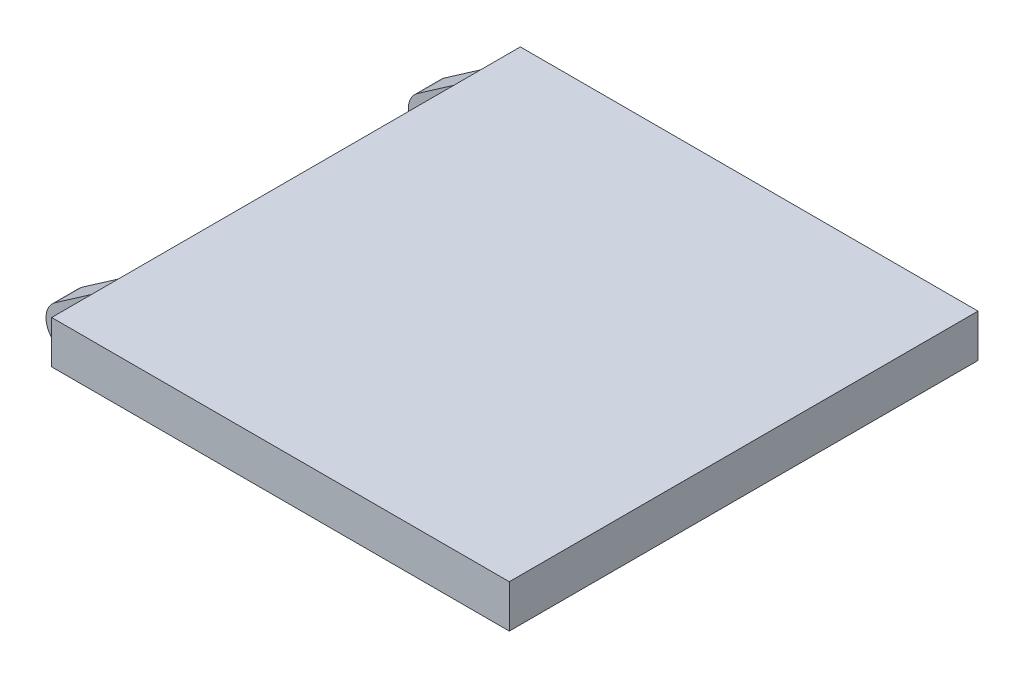
from build123d import *

# Parameters (mm, degrees)
SKETCH1_W           = 85.558202154
SKETCH1_H           = 87.623993754
BOSS_EXTRUDE1_DEPTH = 8
BOSS_EXTRUDE2_START = 0.6
BOSS_EXTRUDE2_DEPTH = 5
SKETCH3_R           = 2
BOSS_EXTRUDE3_DEPTH = 3.8
BOSS_EXTRUDE3_TAPER = 14
FILLET1_R           = 1


with BuildPart() as part:
    # Sketch1 → Boss-Extrude1 (new body)
    with BuildSketch(Plane(origin=(0, 0, 0), x_dir=(1, 0, 0), z_dir=(0, 1, 0))):
        Rectangle(SKETCH1_W, SKETCH1_H)
    extrude(amount=BOSS_EXTRUDE1_DEPTH)


with BuildPart() as body_2:
    # Sketch2 → Boss-Extrude2 (new body)
    with BuildSketch(Plane(origin=(0, 0, 36.97), x_dir=(-1, 0, 0), z_dir=(0, 0, -1)).offset(BOSS_EXTRUDE2_START)):
        with BuildLine():
            Line((42.779101077, 0), (42.779101077, 8))
            Line((42.779101077, 8), (49.562346018, 3.284325279))
            ThreePointArc((49.562346018, 3.284325279), (49.132074395, -3.544924524), (43.279101077, 0))
            Line((43.279101077, 0), (42.779101077, 0))
        make_face()
    extrude(amount=BOSS_EXTRUDE2_DEPTH)


with BuildPart() as body_3:
    # Sketch3 → Boss-Extrude3 (new body)
    with BuildSketch(Plane(origin=(0, 0, 36.97), x_dir=(-1, 0, 0), z_dir=(0, 0, -1))):
        with Locations((47.279101077, 0)):
            Circle(SKETCH3_R)
    extrude(amount=BOSS_EXTRUDE3_DEPTH, taper=BOSS_EXTRUDE3_TAPER)

    # Fillet1
    fillet1_edges = [body_3.edges().sort_by_distance(p)[0] for p in [
        (-46.226547488, 0, 33.17),
    ]]
    fillet(fillet1_edges, radius=FILLET1_R)


with BuildPart() as body_2_1:
    add(body_2.part)

    # Combine1: cut body 3
    add(body_3.part, mode=Mode.SUBTRACT)


with BuildPart() as body_3_2:
    # Mirror1: mirrored copy
    add(body_2_1.part.mirror(Plane(origin=(0, 0, 0), x_dir=(1, 0, 0), z_dir=(0, 0, -1))))


solid = Compound([part.part, body_2_1.part, body_3_2.part])
